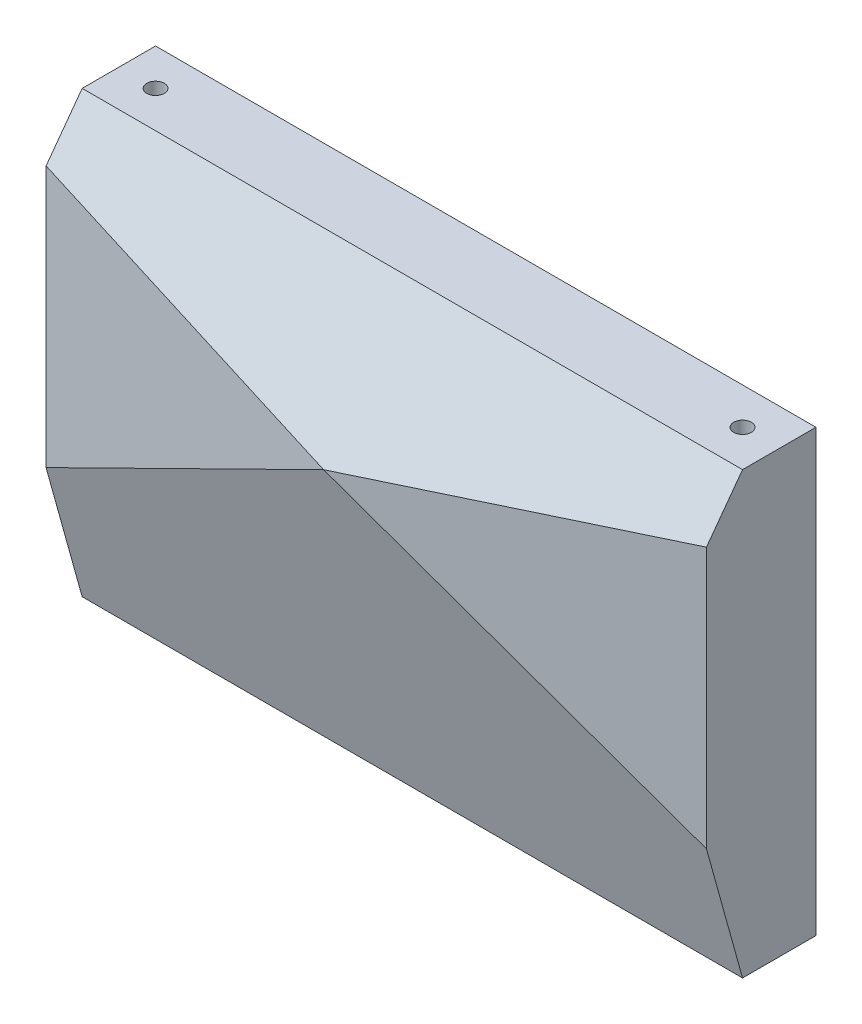
from build123d import *

# Parameters (mm, degrees)
SKIZZE1_W                       = 90
SKIZZE1_H                       = 60
AUFSATZ_LINEAR_AUSTRAGEN1_DEPTH = 10
SCHNITT_LINEAR_AUSTRAGEN1_DEPTH = 10
SKIZZE3_R                       = 1.2
SCHNITT_LINEAR_AUSTRAGEN2_DEPTH = 68
AUFSATZ_LINEAR_AUSTRAGEN2_DEPTH = 90
SCHNITT_LINEAR_AUSTRAGEN4_DEPTH = 90


with BuildPart() as part:
    # Skizze1 → Aufsatz-Linear austragen1 (new body)
    with BuildSketch(Plane.XY):
        with Locations((45, 30)):
            Rectangle(SKIZZE1_W, SKIZZE1_H)
    extrude(amount=AUFSATZ_LINEAR_AUSTRAGEN1_DEPTH)

    # Skizze2 → Schnitt-Linear austragen1 (cut)
    with BuildSketch(Plane.XY.offset(10)):
        with BuildLine():
            Line((10, 50.05034464), (10, 9.94965536))
            ThreePointArc((10, 9.94965536), (11.096486968, 8.165372815), (13.183664201, 8.337532828))
            Line((13.183664201, 8.337532828), (40.491757454, 28.387877468))
            ThreePointArc((40.491757454, 28.387877468), (41.308093253, 30), (40.491757454, 31.612122532))
            Line((40.491757454, 31.612122532), (13.183664201, 51.662467172))
            ThreePointArc((13.183664201, 51.662467172), (11.096486968, 51.834627185), (10, 50.05034464))
        make_face()
        with BuildLine():
            Line((43.816335799, 35.160742066), (23.07733899, 50.387877468))
            ThreePointArc((23.07733899, 50.387877468), (22.360444711, 52.622798095), (24.261003191, 54))
            Line((24.261003191, 54), (65.738996809, 54))
            ThreePointArc((65.738996809, 54), (67.639555289, 52.622798095), (66.92266101, 50.387877468))
            Line((66.92266101, 50.387877468), (46.183664201, 35.160742066))
            ThreePointArc((46.183664201, 35.160742066), (45, 34.772864599), (43.816335799, 35.160742066))
        make_face()
        with BuildLine():
            Line((24.261003191, 6), (65.738996809, 6))
            ThreePointArc((65.738996809, 6), (67.639555289, 7.377201905), (66.92266101, 9.612122532))
            Line((66.92266101, 9.612122532), (46.183664201, 24.839257934))
            ThreePointArc((46.183664201, 24.839257934), (45, 25.227135401), (43.816335799, 24.839257934))
            Line((43.816335799, 24.839257934), (23.07733899, 9.612122532))
            ThreePointArc((23.07733899, 9.612122532), (22.360444711, 7.377201905), (24.261003191, 6))
        make_face()
        with BuildLine():
            Line((80, 50.05034464), (80, 9.94965536))
            ThreePointArc((80, 9.94965536), (78.903513032, 8.165372815), (76.816335799, 8.337532828))
            Line((76.816335799, 8.337532828), (49.508242546, 28.387877468))
            ThreePointArc((49.508242546, 28.387877468), (48.691906747, 30), (49.508242546, 31.612122532))
            Line((49.508242546, 31.612122532), (76.816335799, 51.662467172))
            ThreePointArc((76.816335799, 51.662467172), (78.903513032, 51.834627185), (80, 50.05034464))
        make_face()
    extrude(amount=-SCHNITT_LINEAR_AUSTRAGEN1_DEPTH, mode=Mode.SUBTRACT)

    # Skizze3 → Schnitt-Linear austragen2 (cut)
    with BuildSketch(Plane(origin=(0, 60, 0), x_dir=(1, 0, 0), z_dir=(0, 1, 0))):
        with Locations(Location((5, -5, 0), (0, 0, 270))):
            Circle(SKIZZE3_R)
        with Locations(Location((85, -5, 0), (0, 0, 270))):
            Circle(SKIZZE3_R)
    extrude(amount=-SCHNITT_LINEAR_AUSTRAGEN2_DEPTH, mode=Mode.SUBTRACT)

    # Skizze4 → Aufsatz-Linear austragen2 (add)
    with BuildSketch(Plane(origin=(90, 0, 0), x_dir=(0, 0, -1), z_dir=(1, 0, 0))):
        Polygon((-10, 60), (-10, 0), (-22.096946665, 43.542338596), align=None)
    extrude(amount=-AUFSATZ_LINEAR_AUSTRAGEN2_DEPTH)

    # Skizze5 → Schnitt-Linear austragen4 (cut)
    with BuildSketch(Plane(origin=(0, 60, 0), x_dir=(1, 0, 0), z_dir=(0, 1, 0))):
        Polygon((90, -14.917881766), (45, -22.096946665), (90, -22.096946665), align=None)
        Polygon((45, -22.096946665), (0, -14.917881766), (0, -22.096946665), align=None)
    extrude(amount=-SCHNITT_LINEAR_AUSTRAGEN4_DEPTH, mode=Mode.SUBTRACT)


solid = part.part
